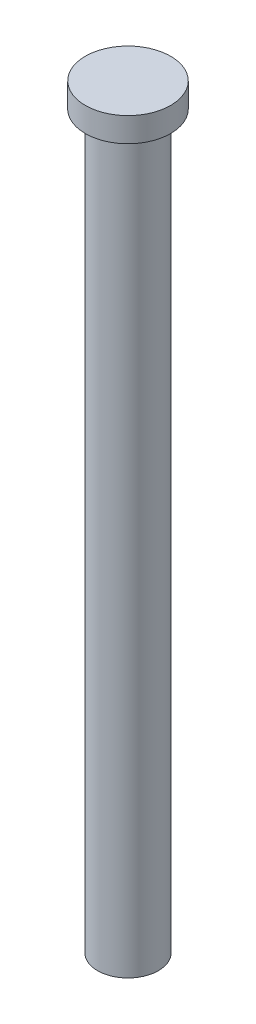
from build123d import *

# Parameters (mm, degrees)
SKETCH1_R           = 6.35
BOSS_EXTRUDE1_DEPTH = 152.4
SKETCH2_R           = 8.89
BOSS_EXTRUDE2_DEPTH = 5.08


with BuildPart() as part:
    # Sketch1 → Boss-Extrude1 (new body)
    with BuildSketch(Plane(origin=(0, 0, 0), x_dir=(1, 0, 0), z_dir=(0, 1, 0))):
        with Locations(Location((0, 0, 0), (0, 0, 90))):
            Circle(SKETCH1_R)
    extrude(amount=BOSS_EXTRUDE1_DEPTH)

    # Sketch2 → Boss-Extrude2 (add)
    with BuildSketch(Plane(origin=(0, 152.4, 0), x_dir=(1, 0, 0), z_dir=(0, 1, 0))):
        with Locations(Location((0, 0, 0), (0, 0, 270))):
            Circle(SKETCH2_R)
    extrude(amount=BOSS_EXTRUDE2_DEPTH)


solid = part.part
